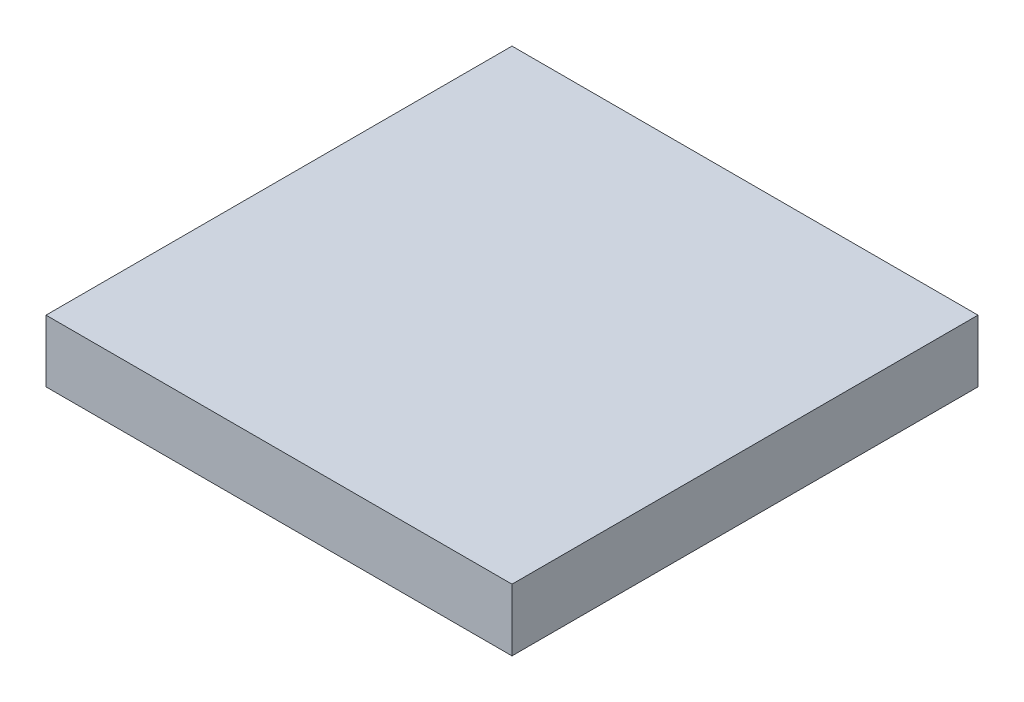
from build123d import *

# Parameters (mm, degrees)
SKETCH1_W           = 15
SKETCH1_H           = 15
BOSS_EXTRUDE1_DEPTH = 2


with BuildPart() as part:
    # Sketch1 → Boss-Extrude1 (new body)
    with BuildSketch(Plane(origin=(0, 0, 0), x_dir=(1, 0, 0), z_dir=(0, 1, 0))):
        with Locations((-18.029411765, 5.950980392)):
            Rectangle(SKETCH1_W, SKETCH1_H)
    extrude(amount=BOSS_EXTRUDE1_DEPTH)


solid = part.part
